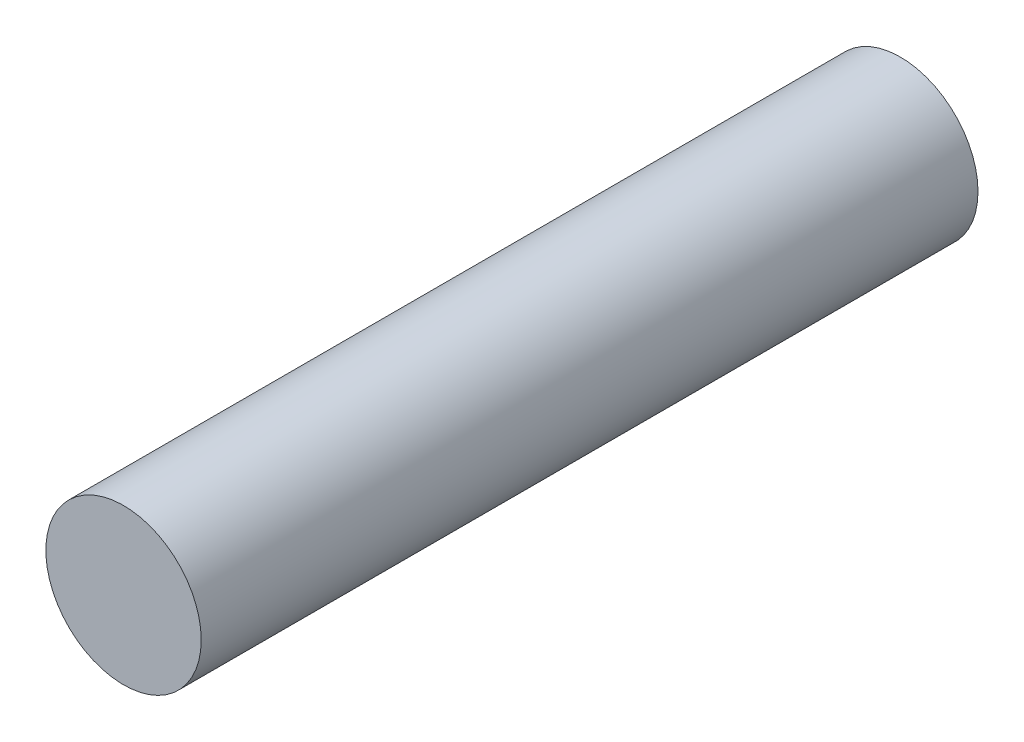
from build123d import *

# Parameters (mm, degrees)
SKETCH1_R           = 100
BOSS_EXTRUDE1_DEPTH = 1000


with BuildPart() as part:
    # Sketch1 → Boss-Extrude1 (new body)
    with BuildSketch(Plane.XY):
        Circle(SKETCH1_R)
    extrude(amount=BOSS_EXTRUDE1_DEPTH)


solid = part.part
